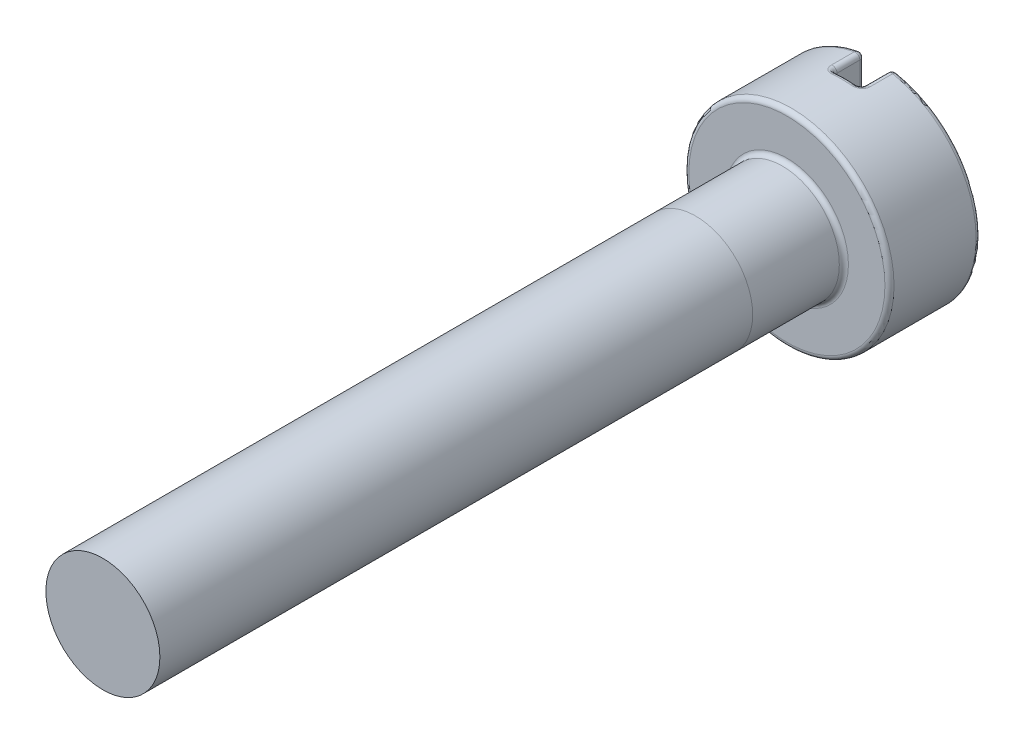
from build123d import *

# Parameters (mm, degrees)
SKETCH1_R           = 0.625
BOSS_EXTRUDE1_DEPTH = 7.5
SKETCH2_R           = 1.125
BOSS_EXTRUDE2_DEPTH = 1
SKETCH3_W           = 0.3
SKETCH3_H           = 13.562630166
CUT_EXTRUDE1_DEPTH  = 0.35
FILLET1_R           = 0.05
FILLET2_R           = 0.05


with BuildPart() as part:
    # Sketch1 → Boss-Extrude1 (new body)
    with BuildSketch(Plane.XY):
        Circle(SKETCH1_R)
    extrude(amount=BOSS_EXTRUDE1_DEPTH)

    # Sketch2 → Boss-Extrude2 (add)
    with BuildSketch(Plane.XY):
        Circle(SKETCH2_R)
    extrude(amount=-BOSS_EXTRUDE2_DEPTH)

    # Sketch3 → Cut-Extrude1 (cut)
    with BuildSketch(Plane(origin=(0, 0, -1), x_dir=(-1, 0, 0), z_dir=(0, 0, -1))):
        Rectangle(SKETCH3_W, SKETCH3_H)
    extrude(amount=-CUT_EXTRUDE1_DEPTH, mode=Mode.SUBTRACT)

    # Fillet1
    fillet1_edges = [part.edges().sort_by_distance(p)[0] for p in [
        (0.846869234, -0.740565662, -1),
        (-0.15, 0, -1),
        (0.15, 0, -1),
        (0, 1.125, -0.65),
        (0, -1.125, -0.65),
        (0.15, 1.114955156, -0.825),
        (0.15, -1.114955156, -0.825),
        (-0.15, -1.114955156, -0.825),
        (-0.15, 1.114955156, -0.825),
        (0.15, 0, -0.65),
        (-0.15, 0, -0.65),
        (-1.125, 0, -1),
    ]]
    fillet(fillet1_edges, radius=FILLET1_R)

    # Fillet2
    fillet2_edges = [part.edges().sort_by_distance(p)[0] for p in [
        (-0.625, 0, 0),
        (-1.125, 0, 0),
    ]]
    fillet(fillet2_edges, radius=FILLET2_R)


solid = part.part
